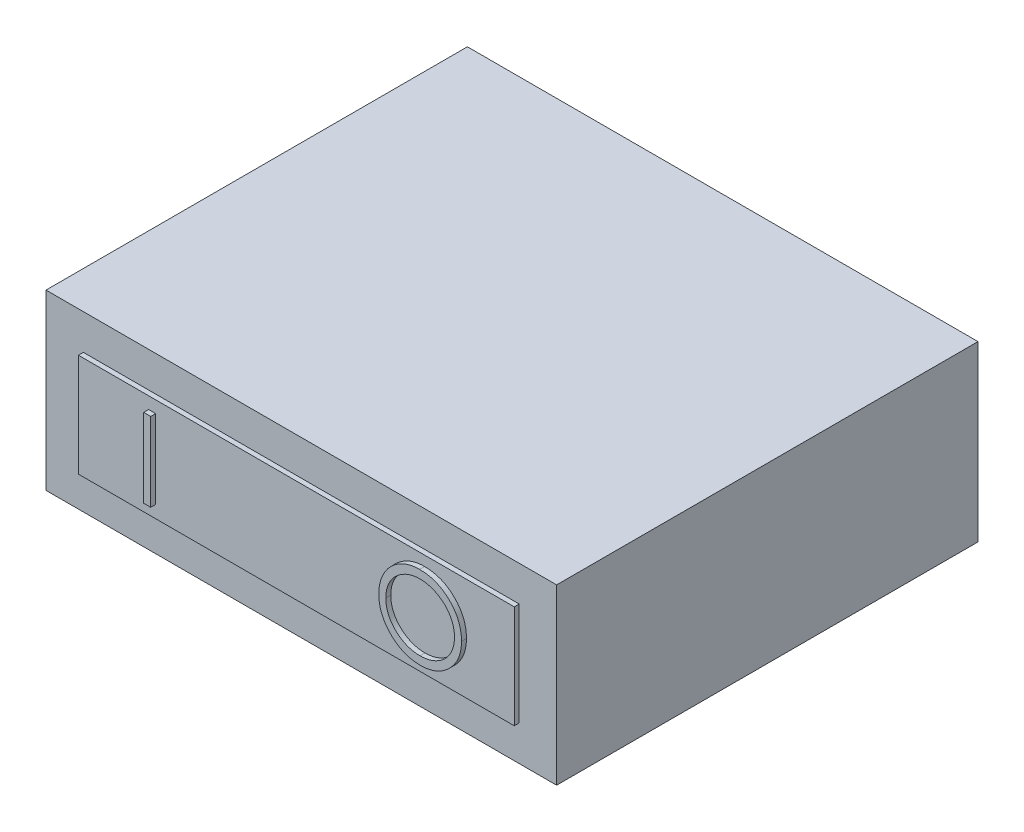
from build123d import *

# Parameters (mm, degrees)
SKETCH1_W           = 20.6
SKETCH1_H           = 17
BOSS_EXTRUDE1_DEPTH = 7
SKETCH2_W           = 17.582410578
SKETCH2_H           = 4.15503942
BOSS_EXTRUDE2_DEPTH = 0.2
SKETCH3_W           = 0.284935897
SKETCH3_H           = 3.175
BOSS_EXTRUDE3_DEPTH = 0.2


with BuildPart() as part:
    # Sketch1 → Boss-Extrude1 (new body)
    with BuildSketch(Plane(origin=(0, 0, 0), x_dir=(1, 0, 0), z_dir=(0, 1, 0))):
        Rectangle(SKETCH1_W, SKETCH1_H)
    extrude(amount=BOSS_EXTRUDE1_DEPTH)

    # Sketch2 → Boss-Extrude2 (add)
    with BuildSketch(Plane.XY.offset(8.5)):
        with Locations((0, 3.5)):
            Rectangle(SKETCH2_W, SKETCH2_H)
    extrude(amount=BOSS_EXTRUDE2_DEPTH)

    # Sketch3 → Boss-Extrude3 (add)
    # profile 1 of 2: a face of its own
    with BuildSketch(Plane.XY.offset(8.7)):
        with Locations((-5.816789994, 3.509432337)):
            Rectangle(SKETCH3_W, SKETCH3_H)
    # profile 2 of 2: a face of its own
    with BuildSketch(Plane.XY.offset(8.7)):
        with BuildLine():
            add(Edge.make_bspline(
                [(5.173594622, 5.178342594), (5.232384832, 5.176853538), (5.347853656, 5.173928908), (5.517557313, 5.151541436), (5.679568578, 5.112810618), (5.835207204, 5.061227769), (5.982611547, 4.992417005), (6.122891114, 4.909245478), (6.255712135, 4.810841833), (6.379284388, 4.697966749), (6.492366051, 4.575154616), (6.591993819, 4.444092511), (6.675489328, 4.305572884), (6.744056435, 4.160011987), (6.797848745, 4.007739016), (6.834968163, 3.847942171), (6.8586792, 3.681656816), (6.861451226, 3.568239589), (6.862857443, 3.510704373)],
                knots=[0, 0, 0, 0, 1.065120563, 2.091984664, 3.0946048, 4.079830382, 5.057816894, 6.036188127, 7.030412546, 8.04752943, 9.064399622, 10.05169764, 11.02544977, 11.989514704, 12.962713494, 13.945757189, 14.957906945, 16, 16, 16, 16], degree=3))
            add(Edge.make_bspline(
                [(6.862857443, 3.510704373), (6.861451432, 3.453592975), (6.858680023, 3.341019794), (6.834941204, 3.175789669), (6.797711154, 3.016957394), (6.744555969, 2.864788124), (6.676315714, 2.719121334), (6.592264237, 2.580340311), (6.493257568, 2.448399559), (6.38058421, 2.324744499), (6.257756122, 2.211353936), (6.126011523, 2.112548956), (5.988313297, 2.027527786), (5.84288949, 1.95968831), (5.691668742, 1.905466639), (5.533297635, 1.868498182), (5.368518261, 1.844652079), (5.256149565, 1.841913853), (5.199035327, 1.840522081)],
                knots=[0, 0, 0, 0, 1.043624062, 2.057103931, 3.04512605, 4.022047818, 4.998200453, 5.980619268, 6.982898556, 8.009068085, 9.034988726, 10.034168286, 11.015286542, 11.987931943, 12.962482838, 13.94673481, 14.956375938, 16, 16, 16, 16], degree=3))
            add(Edge.make_bspline(
                [(5.199035327, 1.840522081), (5.141500409, 1.841927596), (5.028083771, 1.844698241), (4.86158946, 1.868448515), (4.701680364, 1.905588127), (4.548813774, 1.958664544), (4.402904445, 2.027260174), (4.263667012, 2.110902718), (4.131660357, 2.210150625), (4.007978916, 2.322787446), (3.894813572, 2.445407354), (3.796153281, 2.576792714), (3.712491928, 2.714365878), (3.64412662, 2.858508632), (3.590002431, 3.008524155), (3.553077346, 3.165413131), (3.529186876, 3.328281112), (3.526433836, 3.439172884), (3.52503693, 3.49543995)],
                knots=[0, 0, 0, 0, 1.053102029, 2.075944431, 3.073151272, 4.055350789, 5.033113405, 6.020478099, 7.024410459, 8.052272461, 9.079885166, 10.07527673, 11.055994387, 12.023226415, 12.992069828, 13.970394897, 14.97016774, 16, 16, 16, 16], degree=3))
            add(Edge.make_bspline(
                [(3.52503693, 3.49543995), (3.525521921, 3.533206728), (3.526485784, 3.60826384), (3.538089676, 3.719721399), (3.554927791, 3.829386495), (3.579059526, 3.936947284), (3.610620538, 4.042140463), (3.647860591, 4.145691512), (3.693344594, 4.246551033), (3.744762039, 4.345196824), (3.802149536, 4.440091139), (3.865536823, 4.529789046), (3.932697479, 4.615043236), (4.006324272, 4.693644447), (4.083990618, 4.767879264), (4.166956433, 4.836606871), (4.254715469, 4.900447005), (4.347645342, 4.957978315), (4.443456206, 5.010011244), (4.542222997, 5.054662494), (4.642604315, 5.092985707), (4.745070317, 5.124047027), (4.849348903, 5.148568946), (4.955667665, 5.165267045), (5.063941902, 5.176900534), (5.136886455, 5.177859839), (5.173594622, 5.178342594)],
                knots=[0, 0, 0, 0, 1.037015668, 2.060948919, 3.074880161, 4.083647147, 5.086022904, 6.090072063, 7.104153813, 8.122640571, 9.144368836, 10.147691507, 11.138137339, 12.123020368, 13.103399296, 14.087645067, 15.080126199, 16.082011238, 17.087798457, 18.072939717, 19.057185487, 20.037253025, 21.01195951, 21.997135196, 22.992090687, 24, 24, 24, 24], degree=3))
        make_face()
        with BuildLine():
            add(Edge.make_bspline(
                [(5.18758701, 4.852701568), (5.157456592, 4.852334275), (5.097483806, 4.8516032), (5.008325691, 4.841973229), (4.920340151, 4.828248258), (4.833509015, 4.808670736), (4.748195596, 4.78199706), (4.663604668, 4.751298521), (4.580507612, 4.713905103), (4.499178756, 4.671657007), (4.420334366, 4.624894772), (4.34593713, 4.573213241), (4.275794445, 4.517824409), (4.210078054, 4.458599014), (4.148980919, 4.395235447), (4.091300511, 4.328694308), (4.039348819, 4.257073664), (3.991736903, 4.182315652), (3.949130362, 4.104517646), (3.911243219, 4.0244987), (3.880251582, 3.941606084), (3.854976427, 3.856739098), (3.834021598, 3.770032153), (3.820746539, 3.68082749), (3.811010755, 3.589573352), (3.810321467, 3.527904099), (3.809972827, 3.496711985)],
                knots=[0, 0, 0, 0, 1.008559885, 2.007477868, 2.99961109, 3.989939068, 4.984837346, 5.991145699, 7.001802488, 8.033829008, 9.059044045, 10.069351652, 11.065060232, 12.050310815, 13.029377138, 14.011219647, 14.996725999, 15.989392538, 16.977580475, 17.965360261, 18.951710183, 19.937753436, 20.929683414, 21.935841486, 22.955955122, 24, 24, 24, 24], degree=3))
            add(Edge.make_bspline(
                [(3.809972827, 3.496711985), (3.811129309, 3.450844827), (3.813404467, 3.360609939), (3.83332312, 3.228377409), (3.864004482, 3.10129732), (3.909232236, 2.980065017), (3.965793151, 2.863638418), (4.035667544, 2.753050351), (4.118452572, 2.648270929), (4.212490199, 2.55003165), (4.315290083, 2.460364384), (4.42444906, 2.381657578), (4.538797689, 2.315063994), (4.658634166, 2.26081225), (4.783318719, 2.217822988), (4.913654784, 2.18836023), (5.048774129, 2.168969638), (5.140876938, 2.167107495), (5.18758701, 2.166163107)],
                knots=[0, 0, 0, 0, 1.032063989, 2.030389145, 3.003944642, 3.970395727, 4.937377036, 5.913328081, 6.909231446, 7.93887556, 8.970685674, 9.976071282, 10.964166581, 11.944589148, 12.933237628, 13.927779006, 14.949070134, 16, 16, 16, 16], degree=3))
            add(Edge.make_bspline(
                [(5.18758701, 2.166163107), (5.218982772, 2.166594457), (5.281249998, 2.167449954), (5.373865222, 2.176066611), (5.464811928, 2.189884093), (5.553962553, 2.20977833), (5.641215918, 2.234676868), (5.726936204, 2.264256735), (5.810210367, 2.301160398), (5.892088934, 2.341934612), (5.970462668, 2.388416755), (6.045279758, 2.438344219), (6.114654397, 2.493651468), (6.180321626, 2.551996912), (6.241669601, 2.614556974), (6.298283465, 2.681250318), (6.349972585, 2.752497914), (6.397566421, 2.827142532), (6.440023667, 2.905153419), (6.477016135, 2.985462484), (6.508399755, 3.067871976), (6.533734898, 3.152500758), (6.553588139, 3.2391881), (6.56726778, 3.328050071), (6.576836721, 3.418908903), (6.57755797, 3.480362258), (6.577921545, 3.51134039)],
                knots=[0, 0, 0, 0, 1.047197238, 2.076906641, 3.100256066, 4.114471768, 5.12198147, 6.126382909, 7.136867548, 8.15857795, 9.17633901, 10.174870724, 11.156907918, 12.133735059, 13.104061851, 14.077631395, 15.04955518, 16.038496417, 17.029181396, 18.010275684, 18.986308667, 19.968651475, 20.955262928, 21.950658345, 22.966943676, 24, 24, 24, 24], degree=3))
            add(Edge.make_bspline(
                [(6.577921545, 3.51134039), (6.577557678, 3.542106598), (6.576835882, 3.603137038), (6.567272351, 3.693362208), (6.553573686, 3.781584765), (6.533831801, 3.867458357), (6.508386304, 3.951004876), (6.477010655, 4.032145855), (6.440012562, 4.111183575), (6.397550815, 4.187922687), (6.349820747, 4.261559771), (6.297665255, 4.331956245), (6.240183832, 4.397790089), (6.179018795, 4.460686561), (6.112642349, 4.519304218), (6.041355168, 4.573662505), (5.966022689, 4.625073261), (5.886260125, 4.671451449), (5.803942396, 4.714281503), (5.719474734, 4.750976342), (5.633814051, 4.782156764), (5.547178177, 4.80875144), (5.458837904, 4.828171581), (5.369390145, 4.841985598), (5.278958653, 4.851599848), (5.218140875, 4.852333163), (5.18758701, 4.852701568)],
                knots=[0, 0, 0, 0, 1.02996197, 2.043119294, 3.035359645, 4.018872909, 4.991431989, 5.957985074, 6.929999688, 7.912076566, 8.892894881, 9.867085534, 10.843653904, 11.817741046, 12.803660682, 13.806313499, 14.818574707, 15.856120519, 16.894564902, 17.924820532, 18.937903209, 19.946497019, 20.957711757, 21.963978472, 22.977135795, 24, 24, 24, 24], degree=3))
        make_face(mode=Mode.SUBTRACT)
    extrude(amount=BOSS_EXTRUDE3_DEPTH)


solid = part.part
